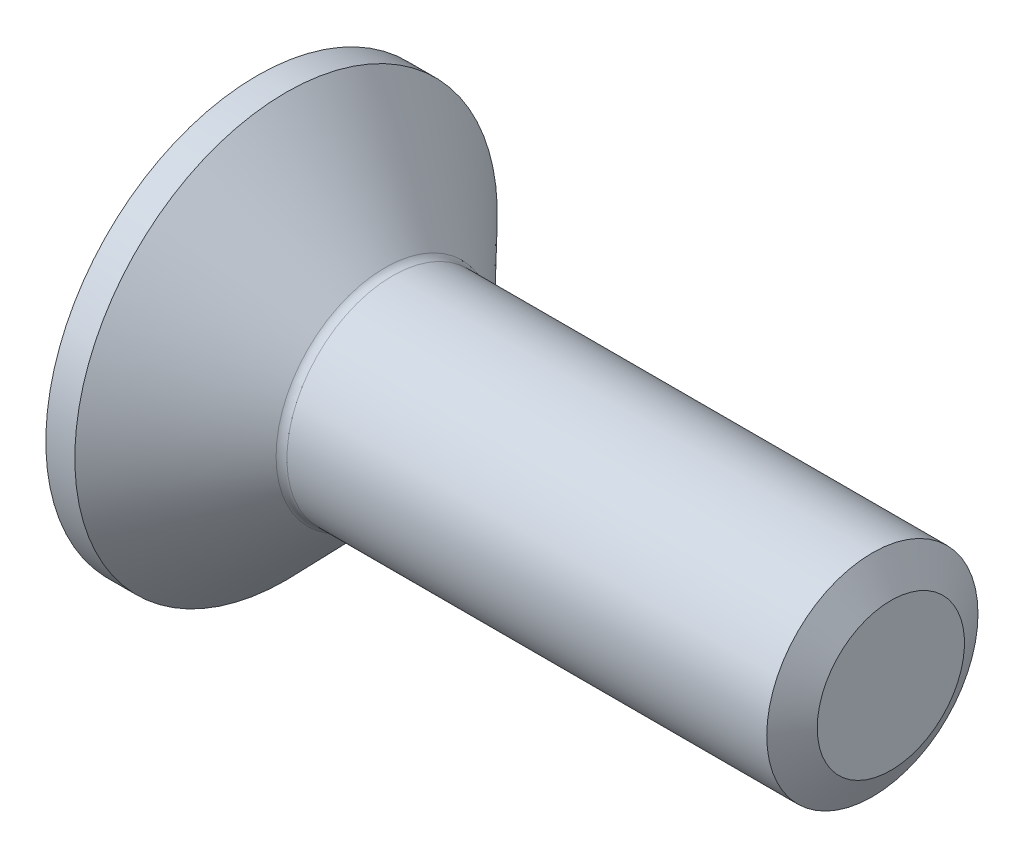
from build123d import *

# Parameters (mm, degrees)
CUT_EXTRUDE_1_DEPTH = 2.58


with BuildPart() as part:
    # 草图1 → 旋转1 (revolve)
    with BuildSketch(Plane.XY):
        with BuildLine():
            Line((0, 2), (-9.435105037, 2))
            ThreePointArc((-9.435105037, 2), (-9.513251262, 2.015899029), (-9.578972997, 2.061068326))
            Line((-9.578972997, 2.061068326), (-11.45137755, 4))
            Line((-11.45137755, 4), (-12, 4))
            Line((-12, 4), (-12, 0))
            Line((-12, 0), (0, 0))
            Line((0, 0), (0, 2))
        make_face()
    revolve(axis=Axis((0, 0, 0), (-1, 0, 0)))

    # 草图2 → 切除-拉伸1 (cut)
    with BuildSketch(Plane.ZY.offset(12)):
        Polygon((0, 1.443375673), (-1.25, 0.721687836), (-1.25, -0.721687836), (0, -1.443375673), (1.25, -0.721687836), (1.25, 0.721687836), align=None)
    extrude(amount=-CUT_EXTRUDE_1_DEPTH, mode=Mode.SUBTRACT)

    # 草图6 → 旋转2 (revolve)
    with BuildSketch(Plane.XY):
        Polygon((-10.5, 1.443375673), (-9.666666667, 0), (-9.05, 0), (-9.05, 1.443375673), align=None)
    revolve(axis=Axis((-12, 0, 0), (1, 0, 0)))

    # 草图7 → 切除-旋转2 (revolve, cut)
    with BuildSketch(Plane.XY):
        Polygon((-12, 1.443375673), (-12, 0), (-11.593, 0), align=None)
    revolve(axis=Axis((-12, 0, 0), (1, 0, 0)), mode=Mode.SUBTRACT)

    # 草图4 → 切除-旋转1 (revolve, cut)
    with BuildSketch(Plane.XY):
        Polygon((-0.35, 2), (0, 1.393782217), (0.35, 2), align=None)
    revolve(axis=Axis((-0.35, 0, 0), (1, 0, 0)), mode=Mode.SUBTRACT)


solid = part.part
